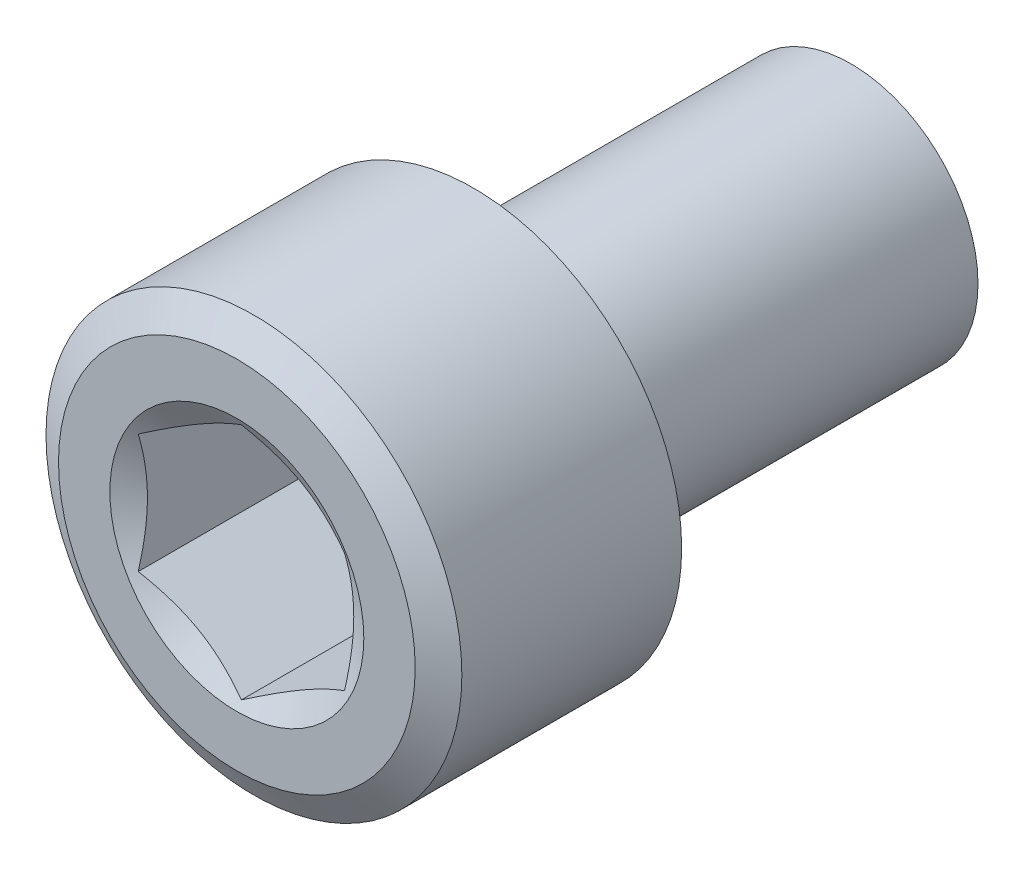
from build123d import *

# Parameters (mm, degrees)
CHAMFER1_SIZE           = 0.8
CUT_EXTRUDE1_DEPTH      = 6
CUT_EXTRUDE2_DEPTH      = 21
CUT_EXTRUDE2_DEPTH_BACK = 18
SKETCH17_W              = 9.291812213
SKETCH17_H              = 14.847741165
CUT_EXTRUDE3_DEPTH      = 18
CUT_EXTRUDE3_DEPTH_BACK = 18
SKETCH18_W              = 16.942014586
SKETCH18_H              = 5.743756165
CUT_EXTRUDE4_DEPTH      = 36
CUT_EXTRUDE4_DEPTH_BACK = 60
SKETCH19_W              = 5.251267682
SKETCH19_H              = 11.080799959


with BuildPart() as part:
    # Sketch1 → Revolve1 (revolve)
    with BuildSketch(Plane(origin=(0, 0, 0), x_dir=(0, 0, -1), z_dir=(1, 0, 0)), mode=Mode.PRIVATE) as revolve1_sk:
        Polygon((0, 0), (0, 5.618156666), (0.538, 6.55), (7.462, 6.55), (8, 5.618156666), (8, 4), (38, 4), (38, 0), align=None)
    revolve(revolve1_sk.sketch.rotate(Axis((0, 0, 0), (0, 0, -1)), 90), axis=Axis((0, 0, 0), (0, 0, -1)))

    # Chamfer1
    chamfer1_edges = [part.edges().sort_by_distance(p)[0] for p in [
        (-4, 0, -38),
    ]]
    chamfer(chamfer1_edges, length=CHAMFER1_SIZE)

    # Sketch2 → Cut-Extrude1 (cut)
    with BuildSketch(Plane.XY):
        Polygon((3.25, 1.876388375), (0, 3.75277675), (-3.25, 1.876388375), (-3.25, -1.876388375), (0, -3.75277675), (3.25, -1.876388375), align=None)
    extrude(amount=-CUT_EXTRUDE1_DEPTH, mode=Mode.SUBTRACT)

    # Sketch3 → Cut-Revolve1 (revolve, cut)
    with BuildSketch(Plane(origin=(0, 0, 0), x_dir=(0, 0, -1), z_dir=(1, 0, 0)), mode=Mode.PRIVATE) as cut_revolve1_sk:
        Polygon((0, 0), (0, 4), (2.309401077, 0), align=None)
        Polygon((6, 0), (6, 3.75277675), (8.166666667, 0), align=None)
    revolve(cut_revolve1_sk.sketch.rotate(Axis((0, 0, 1.402800488), (0, 0, -1)), 90), axis=Axis((0, 0, 1.402800488), (0, 0, -1)), mode=Mode.SUBTRACT)

    # Sketch17 → Cut-Extrude2 (cut, two sides: drawn at the far end of the back side and taken through both)
    with BuildSketch(Plane.ZY.offset(-3.25).offset(-CUT_EXTRUDE2_DEPTH_BACK)):
        with Locations((-34.32554678, -0.925988159)):
            Rectangle(SKETCH17_W, SKETCH17_H)
    extrude(amount=CUT_EXTRUDE2_DEPTH + CUT_EXTRUDE2_DEPTH_BACK, mode=Mode.SUBTRACT)

    # Sketch18 → Cut-Extrude3 (cut, two sides: drawn at the far end of the back side and taken through both)
    with BuildSketch(Plane(origin=(1.625, 2.814582562, 0), x_dir=(0.8660254037844387, -0.49999999999999983, 0), z_dir=(-0.49999999999999983, -0.8660254037844387, 0)).offset(-CUT_EXTRUDE3_DEPTH_BACK)):
        with Locations((1.337252905, -27.251034813)):
            Rectangle(SKETCH18_W, SKETCH18_H)
    extrude(amount=CUT_EXTRUDE3_DEPTH + CUT_EXTRUDE3_DEPTH_BACK, mode=Mode.SUBTRACT)

    # Sketch19 → Cut-Extrude4 (cut, two sides: drawn at the far end of the back side and taken through both)
    with BuildSketch(Plane(origin=(0, 0, 0), x_dir=(0, 0, -1), z_dir=(1, 0, 0)).offset(-CUT_EXTRUDE4_DEPTH_BACK)):
        with Locations((21.973190176, -0.187545275)):
            Rectangle(SKETCH19_W, SKETCH19_H)
    extrude(amount=CUT_EXTRUDE4_DEPTH + CUT_EXTRUDE4_DEPTH_BACK, mode=Mode.SUBTRACT)


solid = part.part
